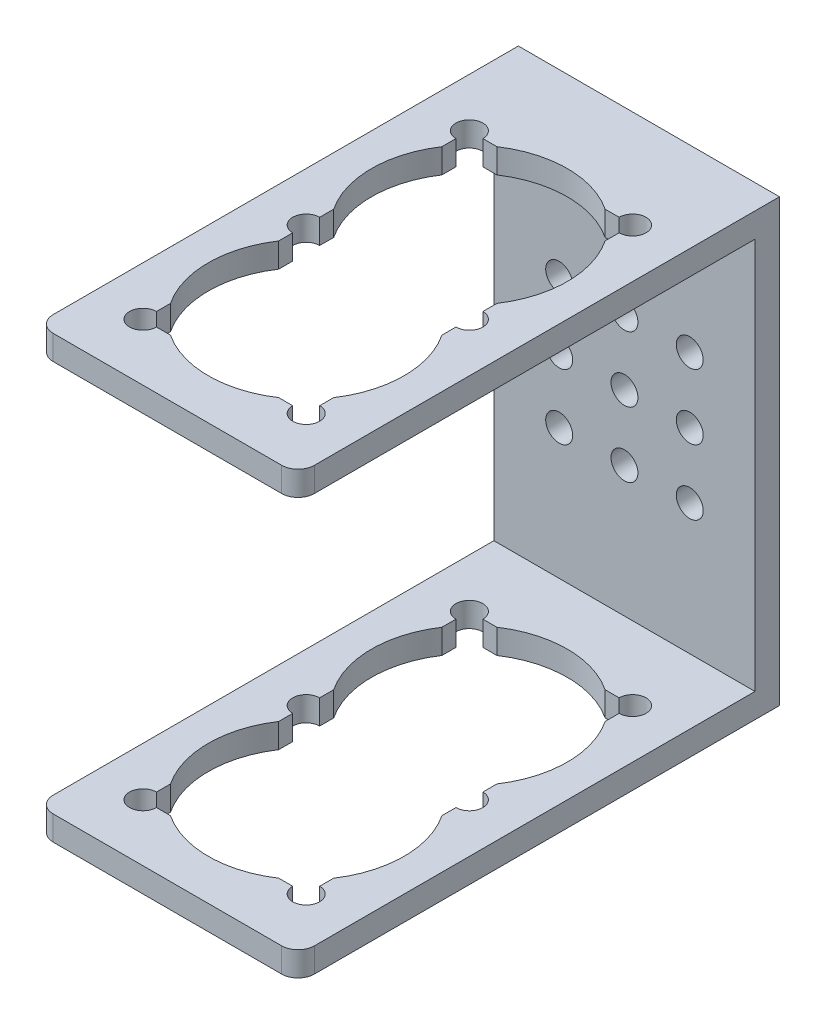
from build123d import *

# Parameters (mm, degrees)
EXTRUDE_1_DEPTH     = 3
SKETCH_2_W          = 32
SKETCH_2_H          = 3
EXTRUDE_2_DEPTH     = 56
SKETCH_3_R          = 1.65
SKETCH_3_R_2        = 12
SKETCH_3_W          = 20
SKETCH_3_H          = 40
CUT_EXTRUDE_2_DEPTH = 58
FILLET_1_R          = 2


with BuildPart() as part:
    # 草图1 → 凸台-拉伸1 (new body)
    with BuildSketch(Plane.XY):
        with BuildLine():
            Line((0, 12), (0, 0))
            Line((0, 0), (0, -15))
            Line((0, -15), (16, -15))
            Line((16, -15), (16, 2.35))
            ThreePointArc((16, 2.35), (14.833273811, 2.833273811), (14.35, 4))
            Line((14.35, 4), (9.65, 4))
            ThreePointArc((9.65, 4), (6.833273811, 2.833273811), (8, 5.65))
            Line((8, 5.65), (8, 10.35))
            ThreePointArc((8, 10.35), (6.35, 12), (8, 13.65))
            Line((8, 13.65), (8, 18.35))
            ThreePointArc((8, 18.35), (6.833273811, 21.166726189), (9.65, 20))
            Line((9.65, 20), (14.35, 20))
            ThreePointArc((14.35, 20), (14.833273811, 21.166726189), (16, 21.65))
            Line((16, 21.65), (16, 39))
            Line((16, 39), (0, 39))
            Line((0, 39), (0, 24))
            Line((0, 24), (0, 12))
        make_face()
        with BuildLine():
            Line((32, 39), (16, 39))
            Line((16, 39), (16, 21.65))
            ThreePointArc((16, 21.65), (17.166726189, 21.166726189), (17.65, 20))
            Line((17.65, 20), (22.35, 20))
            ThreePointArc((22.35, 20), (24, 21.65), (25.65, 20))
            ThreePointArc((25.65, 20), (25.166726189, 18.833273811), (24, 18.35))
            Line((24, 18.35), (24, 13.65))
            ThreePointArc((24, 13.65), (25.166726189, 13.166726189), (25.65, 12))
            Line((25.65, 12), (32, 12))
            Line((32, 12), (32, 24))
            Line((32, 24), (32, 39))
        make_face()
        with BuildLine():
            Line((16, 2.35), (16, -15))
            Line((16, -15), (32, -15))
            Line((32, -15), (32, 0))
            Line((32, 0), (32, 12))
            Line((32, 12), (25.65, 12))
            ThreePointArc((25.65, 12), (25.166726189, 10.833273811), (24, 10.35))
            Line((24, 10.35), (24, 5.65))
            ThreePointArc((24, 5.65), (25.166726189, 5.166726189), (25.65, 4))
            ThreePointArc((25.65, 4), (24, 2.35), (22.35, 4))
            Line((22.35, 4), (17.65, 4))
            ThreePointArc((17.65, 4), (17.166726189, 2.833273811), (16, 2.35))
        make_face()
        with BuildLine():
            ThreePointArc((16, 18.35), (14.833273811, 18.833273811), (14.35, 20))
            Line((14.35, 20), (9.65, 20))
            ThreePointArc((9.65, 20), (9.166726189, 18.833273811), (8, 18.35))
            Line((8, 18.35), (8, 13.65))
            ThreePointArc((8, 13.65), (9.166726189, 13.166726189), (9.65, 12))
            Line((9.65, 12), (14.35, 12))
            ThreePointArc((14.35, 12), (14.833273811, 13.166726189), (16, 13.65))
            Line((16, 13.65), (16, 18.35))
        make_face()
        with BuildLine():
            Line((22.35, 20), (17.65, 20))
            ThreePointArc((17.65, 20), (17.166726189, 18.833273811), (16, 18.35))
            Line((16, 18.35), (16, 13.65))
            ThreePointArc((16, 13.65), (17.166726189, 13.166726189), (17.65, 12))
            Line((17.65, 12), (22.35, 12))
            ThreePointArc((22.35, 12), (22.833273811, 13.166726189), (24, 13.65))
            Line((24, 13.65), (24, 18.35))
            ThreePointArc((24, 18.35), (22.833273811, 18.833273811), (22.35, 20))
        make_face()
        with BuildLine():
            Line((9.65, 4), (14.35, 4))
            ThreePointArc((14.35, 4), (14.833273811, 5.166726189), (16, 5.65))
            Line((16, 5.65), (16, 10.35))
            ThreePointArc((16, 10.35), (14.833273811, 10.833273811), (14.35, 12))
            Line((14.35, 12), (9.65, 12))
            ThreePointArc((9.65, 12), (9.166726189, 10.833273811), (8, 10.35))
            Line((8, 10.35), (8, 5.65))
            ThreePointArc((8, 5.65), (9.166726189, 5.166726189), (9.65, 4))
        make_face()
        with BuildLine():
            ThreePointArc((16, 5.65), (17.166726189, 5.166726189), (17.65, 4))
            Line((17.65, 4), (22.35, 4))
            ThreePointArc((22.35, 4), (22.833273811, 5.166726189), (24, 5.65))
            Line((24, 5.65), (24, 10.35))
            ThreePointArc((24, 10.35), (22.833273811, 10.833273811), (22.35, 12))
            Line((22.35, 12), (17.65, 12))
            ThreePointArc((17.65, 12), (17.166726189, 10.833273811), (16, 10.35))
            Line((16, 10.35), (16, 5.65))
        make_face()
    extrude(amount=EXTRUDE_1_DEPTH)

    # 草图2 → 凸台-拉伸2 (add)
    with BuildSketch(Plane.XY.offset(3)):
        with Locations((16, 37.5)):
            Rectangle(SKETCH_2_W, SKETCH_2_H)
        with Locations((16, -13.5)):
            Rectangle(SKETCH_2_W, SKETCH_2_H)
    extrude(amount=EXTRUDE_2_DEPTH)

    # 草图3 → 切除-拉伸2 (cut)
    with BuildSketch(Plane(origin=(0, 39, 0), x_dir=(1, 0, 0), z_dir=(0, 1, 0))):
        with Locations((6, -52)):
            Circle(SKETCH_3_R)
        with Locations((6, -32)):
            Circle(SKETCH_3_R)
        with Locations((6, -12)):
            Circle(SKETCH_3_R)
        with Locations((26, -12)):
            Circle(SKETCH_3_R)
        with Locations((26, -52)):
            Circle(SKETCH_3_R)
        with Locations((26, -32)):
            Circle(SKETCH_3_R)
        with Locations((16, -42)):
            Circle(SKETCH_3_R_2)
        with Locations((16, -22)):
            Circle(SKETCH_3_R_2)
        with Locations((16, -32)):
            Rectangle(SKETCH_3_W, SKETCH_3_H)
    extrude(amount=-CUT_EXTRUDE_2_DEPTH, mode=Mode.SUBTRACT)

    # 圆角1
    fillet_1_edges = [part.edges().sort_by_distance(p)[0] for p in [
        (0, 37.5, 59),
        (32, 37.5, 59),
        (32, -13.5, 59),
        (0, -13.5, 59),
    ]]
    fillet(fillet_1_edges, radius=FILLET_1_R)


solid = part.part
